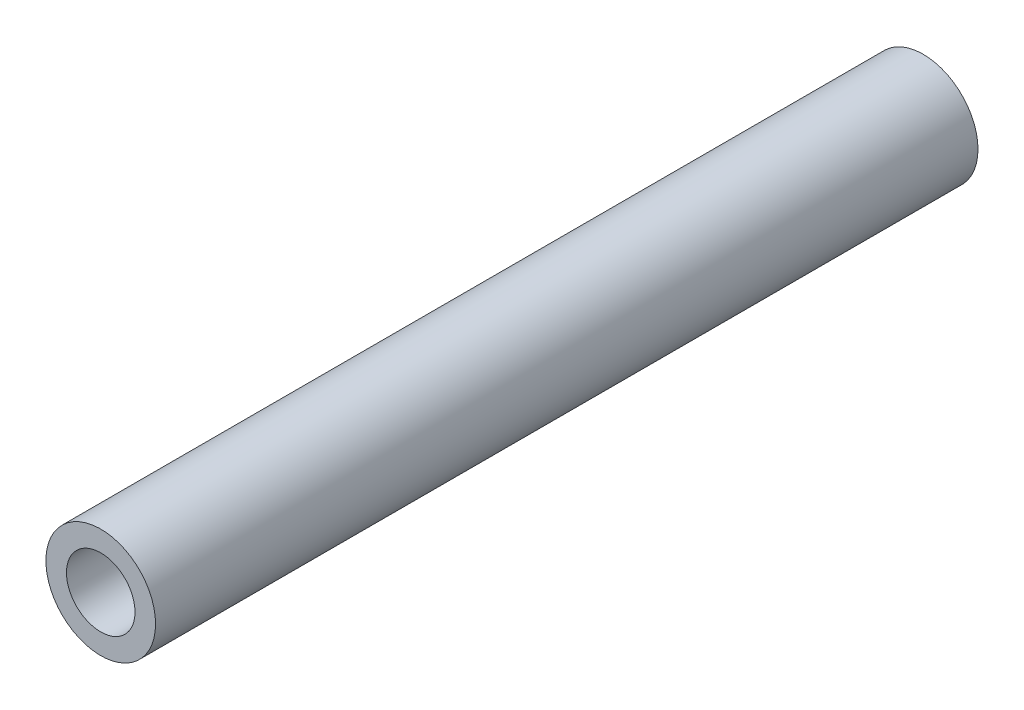
from build123d import *

# Parameters (mm, degrees)
ESQUISSE1_R        = 2
ESQUISSE1_R_2      = 1.25
BOSS_EXTRU_1_DEPTH = 30


with BuildPart() as part:
    # Esquisse1 → Boss.-Extru.1 (new body)
    with BuildSketch(Plane.XY):
        Circle(ESQUISSE1_R)
        Circle(ESQUISSE1_R_2, mode=Mode.SUBTRACT)
    extrude(amount=BOSS_EXTRU_1_DEPTH)


solid = part.part
